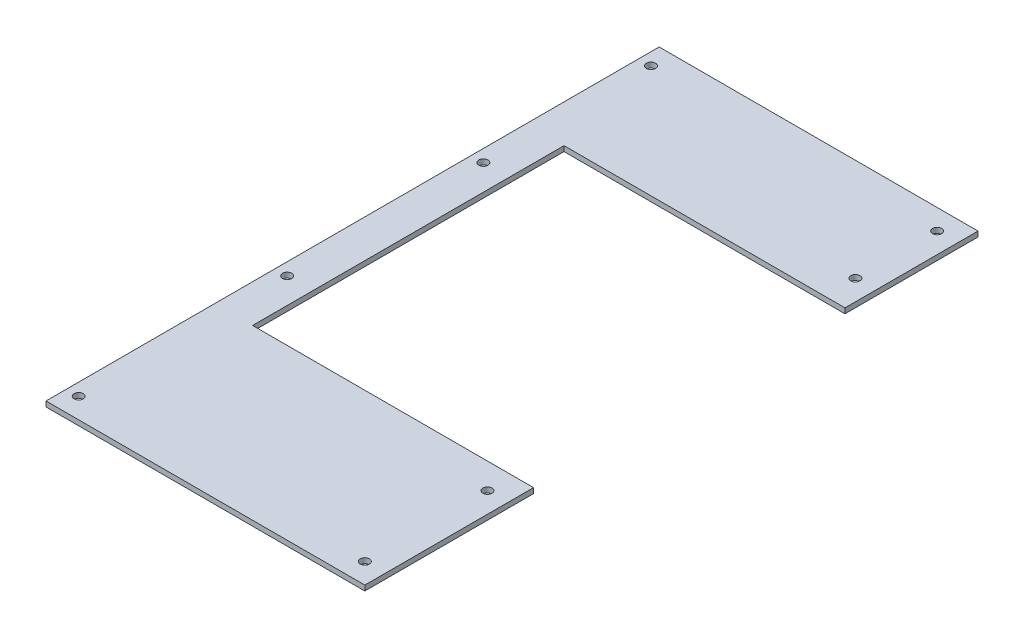
from build123d import *

# Parameters (mm, degrees)
SKETCH1_W           = 200
SKETCH1_H           = 100
SKETCH1_R           = 2.8
SKETCH1_W_2         = 175
SKETCH1_H_2         = 75
BOSS_EXTRUDE1_DEPTH = 3.175
SKETCH2_W           = 171.825
SKETCH2_H           = 6.35
BOSS_EXTRUDE2_DEPTH = 3.175
SKETCH3_W           = 5
SKETCH3_H           = 375
CUT_EXTRUDE1_DEPTH  = 426.011859393


with BuildPart() as part:
    # Sketch1 → Boss-Extrude1 (new body)
    # profile 1 of 3: a face of its own
    with BuildSketch(Plane(origin=(0, 0, 0), x_dir=(-1, 0, 0), z_dir=(0, 1, 0))):
        with Locations((100, 325)):
            Rectangle(SKETCH1_W, SKETCH1_H)
        with Locations(Location((187.5, 362.5, 0), (0, 0, 90))):
            Circle(SKETCH1_R, mode=Mode.SUBTRACT)
        with Locations(Location((12.5, 287.5, 0), (0, 0, 90))):
            Circle(SKETCH1_R, mode=Mode.SUBTRACT)
        with Locations(Location((12.5, 362.5, 0), (0, 0, 90))):
            Circle(SKETCH1_R, mode=Mode.SUBTRACT)
    # profile 2 of 3: a face of its own
    with BuildSketch(Plane(origin=(0, 0, 0), x_dir=(-1, 0, 0), z_dir=(0, 1, 0))):
        Polygon((200, 275), (175, 275), (175, 75), (175, 0), (200, 0), align=None)
        with Locations(Location((187.5, 12.5, 0), (0, 0, 90))):
            Circle(SKETCH1_R, mode=Mode.SUBTRACT)
        with Locations(Location((187.5, 115, 0), (0, 0, 90))):
            Circle(SKETCH1_R, mode=Mode.SUBTRACT)
        with Locations(Location((187.5, 235, 0), (0, 0, 90))):
            Circle(SKETCH1_R, mode=Mode.SUBTRACT)
    # profile 3 of 3: a face of its own
    with BuildSketch(Plane(origin=(0, 0, 0), x_dir=(-1, 0, 0), z_dir=(0, 1, 0))):
        with Locations((87.5, 37.5)):
            Rectangle(SKETCH1_W_2, SKETCH1_H_2)
        with Locations(Location((12.5, 12.5, 0), (0, 0, 90))):
            Circle(SKETCH1_R, mode=Mode.SUBTRACT)
        with Locations(Location((12.5, 62.5, 0), (0, 0, 90))):
            Circle(SKETCH1_R, mode=Mode.SUBTRACT)
    extrude(amount=BOSS_EXTRUDE1_DEPTH)

    # Sketch2 → Boss-Extrude2 (add, through all)
    with BuildSketch(Plane(origin=(0, 3.175, 0), x_dir=(-1, 0, 0), z_dir=(0, 1, 0))):
        Polygon((175, 275), (0, 275), (0, 271.825), (171.825, 271.825), (175, 271.825), align=None)
        Polygon((175, 75), (175, 271.825), (171.825, 271.825), (171.825, 81.35), (171.825, 75), align=None)
        with Locations((85.9125, 78.175)):
            Rectangle(SKETCH2_W, SKETCH2_H)
    extrude(amount=-BOSS_EXTRUDE2_DEPTH)

    # Sketch3 → Cut-Extrude1 (cut, through all)
    with BuildSketch(Plane(origin=(0, 3.175, 0), x_dir=(-1, 0, 0), z_dir=(0, 1, 0))):
        with Locations((197.5, 187.5)):
            Rectangle(SKETCH3_W, SKETCH3_H)
    extrude(amount=-CUT_EXTRUDE1_DEPTH, mode=Mode.SUBTRACT)


solid = part.part
